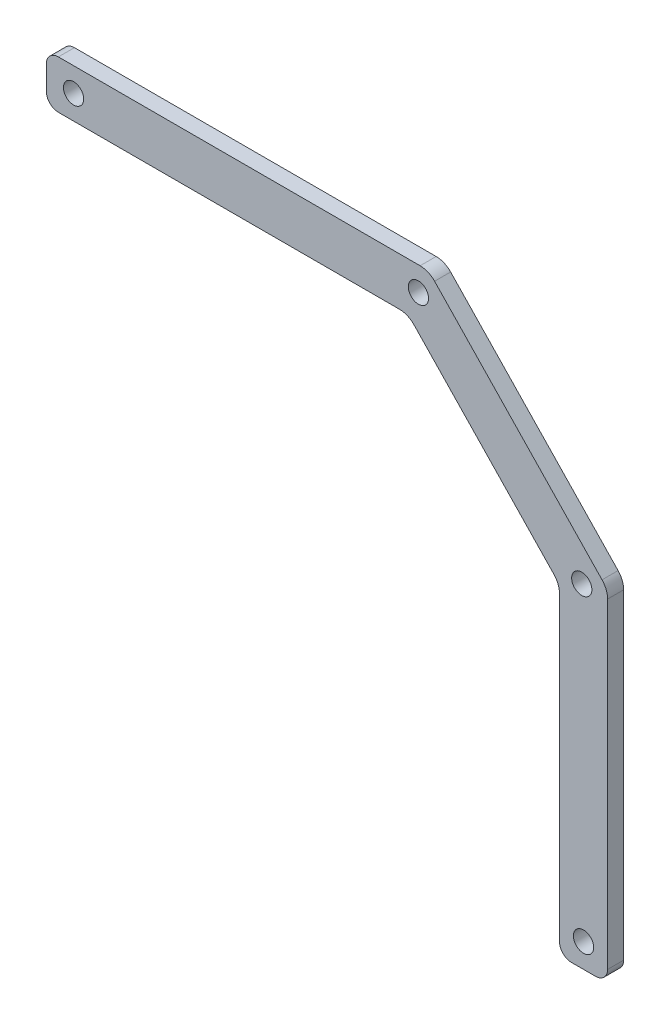
from build123d import *

# Parameters (mm, degrees)
SKETCH_1_W          = 140
SKETCH_1_H          = 140
EXTRUDE_1_DEPTH     = 2
SKETCH_2_R          = 2.525
CUT_EXTRUDE_1_DEPTH = 12
SKETCH_3_R          = 2.525
CUT_EXTRUDE_2_DEPTH = 17
SKETCH_4_OUTSIDE_W  = 181.606
SKETCH_4_OUTSIDE_H  = 181.606
CUT_EXTRUDE_3_DEPTH = 22
FILLET_1_R          = 3
FILLET_2_R          = 3
FILLET_3_R          = 5


with BuildPart() as part:
    # 草图1 → 凸台-拉伸1 (new, symmetric)
    with BuildSketch(Plane.XY):
        Rectangle(SKETCH_1_W, SKETCH_1_H)
    extrude(amount=EXTRUDE_1_DEPTH, both=True)

    # 草图2 → 切除-拉伸1 (cut, symmetric)
    with BuildSketch(Plane.XY.offset(2)):
        with Locations(Location((64, -64, 0), (0, 0, 180))):
            Circle(SKETCH_2_R)
    extrude(amount=CUT_EXTRUDE_1_DEPTH, both=True, mode=Mode.SUBTRACT)

    # 草图3 → 切除-拉伸2 (cut, symmetric)
    with BuildSketch(Plane.XY.offset(2)):
        with Locations(Location((63.551189893, 13.073625474, 0), (0, 0, 180))):
            Circle(SKETCH_3_R)
        with Locations(Location((22.804744615, 55.6226511, 0), (0, 0, 180))):
            Circle(SKETCH_3_R)
        with Locations(Location((-63.213858355, 55.65002484, 0), (0, 0, 180))):
            Circle(SKETCH_3_R)
    extrude(amount=CUT_EXTRUDE_2_DEPTH, both=True, mode=Mode.SUBTRACT)

    # 草图4 outside → 切除-拉伸3 (cut, symmetric)
    with BuildSketch(Plane(origin=(0, 0, -2), x_dir=(-1, 0, 0), z_dir=(0, 0, -1))):
        Rectangle(SKETCH_4_OUTSIDE_W, SKETCH_4_OUTSIDE_H)
        Polygon((-58, -70), (-58, 10.195392206), (-20.216854418, 49.65002484), (70, 49.65002484), (70, 61.6226511), (-25.366420755, 61.6226511), (-70, 15.014528745), (-70, -70), align=None, mode=Mode.SUBTRACT)
    extrude(amount=CUT_EXTRUDE_3_DEPTH, both=True, mode=Mode.SUBTRACT)

    # 圆角1
    fillet_1_edges = [part.edges().sort_by_distance(p)[0] for p in [
        (58, -70, 0),
        (70, -70, 0),
    ]]
    fillet(fillet_1_edges, radius=FILLET_1_R)

    # 圆角2
    fillet_2_edges = [part.edges().sort_by_distance(p)[0] for p in [
        (-70, 61.6226511, 0),
        (-70, 49.65002484, 0),
    ]]
    fillet(fillet_2_edges, radius=FILLET_2_R)

    # 圆角3
    fillet_3_edges = [part.edges().sort_by_distance(p)[0] for p in [
        (70, 15.014528745, 0),
        (25.366420755, 61.6226511, 0),
        (20.216854418, 49.65002484, 0),
        (58, 10.195392206, 0),
    ]]
    fillet(fillet_3_edges, radius=FILLET_3_R)


solid = part.part
